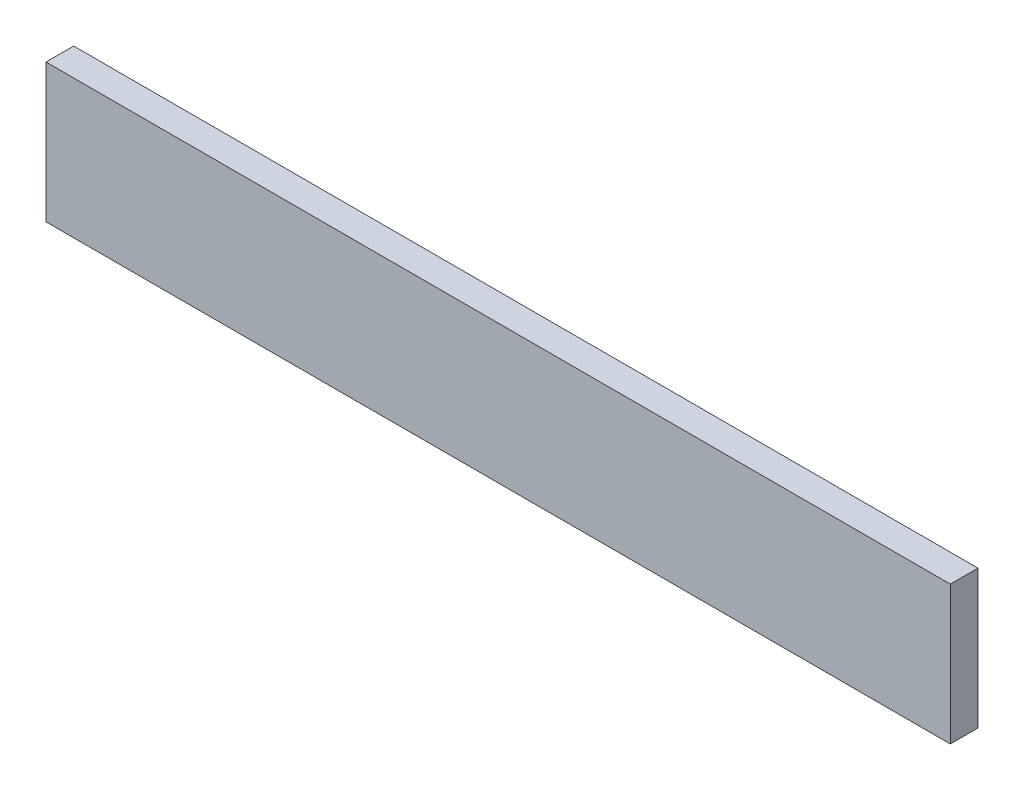
from build123d import *

# Parameters (mm, degrees)
SKETCH1_W           = 49
SKETCH1_H           = 7.5
BOSS_EXTRUDE1_DEPTH = 1.5
SCALE1_SCALE        = 10


with BuildPart() as part:
    # Sketch1 → Boss-Extrude1 (new body)
    with BuildSketch(Plane.XY):
        with Locations((24.5, 3.75)):
            Rectangle(SKETCH1_W, SKETCH1_H)
    extrude(amount=BOSS_EXTRUDE1_DEPTH)


with BuildPart() as part_1:
    # Scale1: scaled about (0, 0, 0)
    add(part.part.scale(SCALE1_SCALE))


solid = part_1.part
